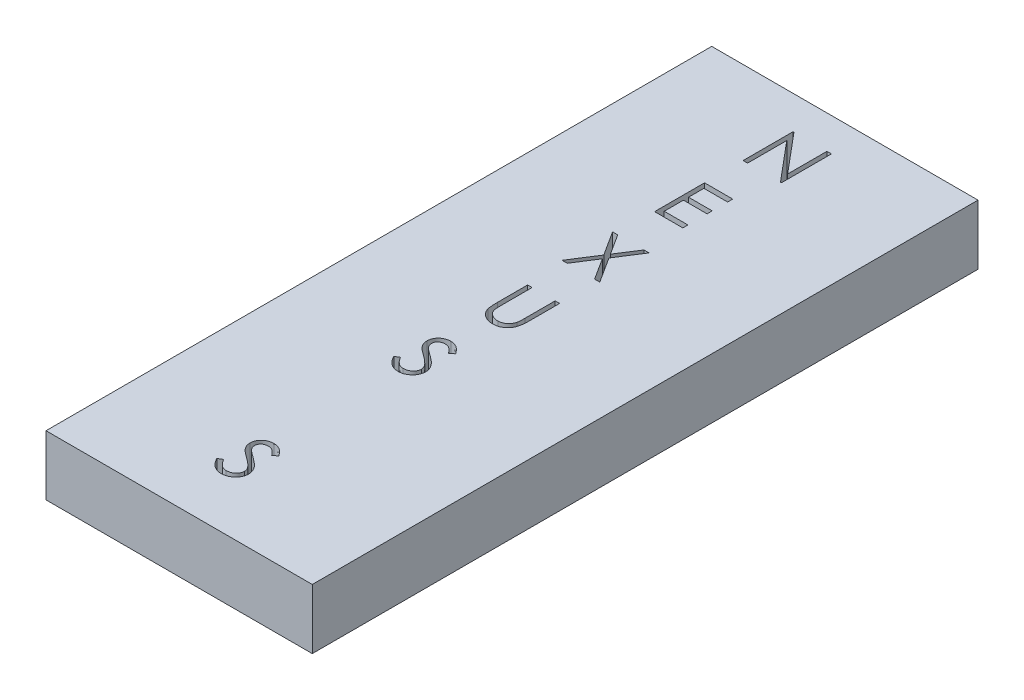
from build123d import *

# Parameters (mm, degrees)
SKETCH1_W           = 50.8
SKETCH1_H           = 127
BOSS_EXTRUDE1_DEPTH = 11.43
CUT_EXTRUDE1_DEPTH  = 138.25991731


with BuildPart() as part:
    # Sketch1 → Boss-Extrude1 (new body)
    with BuildSketch(Plane(origin=(0, 0, 0), x_dir=(1, 0, 0), z_dir=(0, 1, 0))):
        with Locations((25.4, 63.5)):
            Rectangle(SKETCH1_W, SKETCH1_H)
    extrude(amount=BOSS_EXTRUDE1_DEPTH)

    # Sketch2 → Cut-Extrude1 (cut, through all)
    with BuildSketch(Plane(origin=(0, 11.43, 0), x_dir=(1, 0, 0), z_dir=(0, 1, 0))):
        Polygon((21.858653846, 111.125), (21.858653846, 120.65), (22.038010817, 120.65), (28.330769231, 113.153260216), (28.330769231, 120.65), (29.185576923, 120.65), (29.185576923, 111.125), (28.990955529, 111.125), (22.713461538, 118.604567308), (22.713461538, 111.125), align=None)
        Polygon((21.858653846, 103.775), (27.231730769, 103.775), (27.231730769, 102.798076923), (22.713461538, 102.798076923), (22.713461538, 99.867307692), (27.231730769, 99.867307692), (27.231730769, 98.890384615), (22.713461538, 98.890384615), (22.713461538, 95.226923077), (27.231730769, 95.226923077), (27.231730769, 94.25), (21.858653846, 94.25), align=None)
        Polygon((21.187019231, 86.9), (22.173482572, 86.9), (24.667307692, 83.00375601), (27.161132812, 86.9), (28.147596154, 86.9), (25.161493389, 82.232902644), (28.269711538, 77.375), (27.283248197, 77.375), (24.667307692, 81.462049279), (22.051367188, 77.375), (21.064903846, 77.375), (24.175030048, 82.232902644), align=None)
        with BuildLine():
            Line((21.858653846, 70.025), (22.713461538, 70.025))
            Line((22.713461538, 70.025), (22.713461538, 64.318013822))
            add(Edge.make_bspline(
                [(22.713461538, 64.318013822), (22.713334328, 64.23723982), (22.713092924, 64.083957231), (22.714705409, 63.865784927), (22.719221261, 63.671822021), (22.72206831, 63.501320853), (22.728401982, 63.355063805), (22.733567381, 63.232258495), (22.740209182, 63.133486416), (22.748191451, 63.075844038), (22.751622596, 63.051066707)],
                knots=[0, 0, 0, 0, 1.528628734, 2.90083645, 4.128790002, 5.200304208, 6.127813768, 6.898992206, 7.526736466, 8, 8, 8, 8], degree=3))
            add(Edge.make_bspline(
                [(22.751622596, 63.051066707), (22.76571268, 62.961676586), (22.793098923, 62.787933159), (22.862893709, 62.540532764), (22.960368479, 62.317562152), (23.075874188, 62.112063567), (23.228090795, 61.929756809), (23.41043613, 61.761812954), (23.631355629, 61.614932542), (23.87699342, 61.480627833), (24.141748245, 61.372682145), (24.412288905, 61.291057346), (24.684548727, 61.241312626), (24.866819577, 61.235552616), (24.957331731, 61.232692308)],
                knots=[0, 0, 0, 0, 1.035780045, 2.013197591, 2.933192213, 3.817615948, 4.702609284, 5.640816605, 6.646850145, 7.73207398, 8.84249596, 9.914020372, 10.964143139, 12, 12, 12, 12], degree=3))
            add(Edge.make_bspline(
                [(24.957331731, 61.232692308), (25.035038696, 61.235614715), (25.190003811, 61.241442649), (25.420254168, 61.277532686), (25.644500178, 61.342576369), (25.863849172, 61.426504568), (26.069455779, 61.537396227), (26.261434718, 61.665496155), (26.432786567, 61.81574861), (26.589154404, 61.982028833), (26.725320908, 62.169643575), (26.843352372, 62.37450765), (26.940033652, 62.599704087), (26.987777102, 62.757967193), (27.012304687, 62.839272837)],
                knots=[0, 0, 0, 0, 0.994687771, 1.983630487, 2.973142513, 3.978332533, 4.983357753, 5.956394766, 6.925816176, 7.893390482, 8.871859704, 9.88551698, 10.913711441, 12, 12, 12, 12], degree=3))
            add(Edge.make_bspline(
                [(27.012304687, 62.839272837), (27.020469314, 62.8728786), (27.038663393, 62.947765783), (27.05566428, 63.074370152), (27.073371324, 63.223747635), (27.085657403, 63.396971497), (27.09763501, 63.593461287), (27.10480073, 63.814240602), (27.108112798, 64.05850776), (27.109099807, 64.228970321), (27.109615385, 64.318013822)],
                knots=[0, 0, 0, 0, 0.558680831, 1.244966039, 2.062412453, 2.990489873, 4.051219941, 5.244515665, 6.560634259, 8, 8, 8, 8], degree=3))
            Line((27.109615385, 64.318013822), (27.109615385, 70.025))
            Line((27.109615385, 70.025), (27.964423077, 70.025))
            Line((27.964423077, 70.025), (27.964423077, 64.272220553))
            add(Edge.make_bspline(
                [(27.964423077, 64.272220553), (27.963731506, 64.168538536), (27.962381865, 63.966196776), (27.950678153, 63.669693435), (27.932017318, 63.388425678), (27.905651878, 63.122355698), (27.870716891, 62.872435594), (27.831867898, 62.63647476), (27.782393597, 62.416166973), (27.724608413, 62.209794465), (27.658549686, 62.013346746), (27.572984846, 61.826905445), (27.4765796, 61.644802686), (27.362239723, 61.469792761), (27.233757317, 61.301100784), (27.088292386, 61.139749802), (26.93065592, 60.983161397), (26.758227404, 60.835352267), (26.573849189, 60.699801511), (26.378069733, 60.580609005), (26.172392952, 60.479851875), (25.957353487, 60.396913823), (25.732859571, 60.334553378), (25.498905542, 60.288084562), (25.25495888, 60.261680452), (25.089047923, 60.257756342), (25.005033053, 60.255769231)],
                knots=[0, 0, 0, 0, 1.316592851, 2.569410997, 3.76748051, 4.895814652, 5.963796859, 6.97159953, 7.931736103, 8.829262218, 9.692595152, 10.560224239, 11.431080259, 12.30701507, 13.211635791, 14.121146779, 15.063487852, 16.031507147, 17.00238618, 17.966455255, 18.938106653, 19.907068911, 20.888905087, 21.893141452, 22.933117798, 24, 24, 24, 24], degree=3))
            add(Edge.make_bspline(
                [(25.005033053, 60.255769231), (24.913404995, 60.257904913), (24.733631073, 60.262095115), (24.468732476, 60.286105599), (24.214784556, 60.331331372), (23.969105205, 60.388916648), (23.735039224, 60.468338104), (23.509450636, 60.561133715), (23.296203082, 60.675099688), (23.091837053, 60.801900279), (22.901813967, 60.944570187), (22.727377463, 61.100073089), (22.568239558, 61.265917973), (22.427082606, 61.443900397), (22.301567913, 61.632636114), (22.193444975, 61.832659046), (22.100608218, 62.043891749), (22.052693203, 62.19072153), (22.028470553, 62.264948918)],
                knots=[0, 0, 0, 0, 1.13879206, 2.234305948, 3.301075583, 4.341971843, 5.366689343, 6.369221514, 7.369726634, 8.367512178, 9.355451585, 10.318319045, 11.268648973, 12.207971039, 13.137398894, 14.081662264, 15.030215811, 16, 16, 16, 16], degree=3))
            add(Edge.make_bspline(
                [(22.028470553, 62.264948918), (22.014381287, 62.315656139), (21.983821355, 62.425641229), (21.951095366, 62.60766803), (21.923584222, 62.817258628), (21.897715525, 63.054427367), (21.882451146, 63.319358076), (21.869068688, 63.611935911), (21.858559568, 63.93251465), (21.858621542, 64.155820153), (21.858653846, 64.272220553)],
                knots=[0, 0, 0, 0, 0.625038921, 1.35572334, 2.194682327, 3.136881307, 4.189498639, 5.346923369, 6.617055217, 8, 8, 8, 8], degree=3))
            Line((21.858653846, 64.272220553), (21.858653846, 70.025))
        make_face()
        with BuildLine():
            Line((20.881730769, 45.462454928), (21.686929087, 45.945192308))
            add(Edge.make_bspline(
                [(21.686929087, 45.945192308), (21.761818004, 45.819831374), (21.905302279, 45.579644664), (22.14465562, 45.255092425), (22.392667329, 44.979242556), (22.651174015, 44.753699788), (22.918597774, 44.576129604), (23.196684377, 44.45039353), (23.484496705, 44.371972911), (23.680368319, 44.362447676), (23.778155048, 44.357692308)],
                knots=[0, 0, 0, 0, 1.272034388, 2.437168799, 3.508375237, 4.49857839, 5.41946034, 6.295179144, 7.148887113, 8, 8, 8, 8], degree=3))
            add(Edge.make_bspline(
                [(23.778155048, 44.357692308), (23.861667147, 44.360018238), (24.027230079, 44.3646294), (24.270967326, 44.40893644), (24.507682088, 44.477005162), (24.732495595, 44.574489269), (24.942305803, 44.692431862), (25.126292596, 44.834888245), (25.285349518, 44.994380848), (25.415458608, 45.172315072), (25.515280704, 45.363678169), (25.592003405, 45.560099865), (25.634580355, 45.764665755), (25.640994091, 45.902398514), (25.644230769, 45.971905048)],
                knots=[0, 0, 0, 0, 1.095163259, 2.171163733, 3.241058638, 4.321873601, 5.38011039, 6.391990106, 7.366004449, 8.327778327, 9.272591725, 10.192022065, 11.087607919, 12, 12, 12, 12], degree=3))
            add(Edge.make_bspline(
                [(25.644230769, 45.971905048), (25.640218538, 46.051209789), (25.632062258, 46.212424739), (25.563124444, 46.450276652), (25.454677566, 46.685660003), (25.354630657, 46.831259876), (25.302689303, 46.906850962)],
                knots=[0, 0, 0, 0, 0.938893495, 1.908633276, 2.914225137, 4, 4, 4, 4], degree=3))
            add(Edge.make_bspline(
                [(25.302689303, 46.906850962), (25.260042846, 46.96140696), (25.170511943, 47.075940455), (25.016594713, 47.246424988), (24.835984073, 47.4222794), (24.634860827, 47.610218691), (24.405898635, 47.801501909), (24.156268757, 48.00525058), (23.879597826, 48.2137163), (23.685561339, 48.353523068), (23.585441707, 48.425661058)],
                knots=[0, 0, 0, 0, 0.722233717, 1.516239348, 2.393582979, 3.351407094, 4.387010283, 5.505090956, 6.712668013, 8, 8, 8, 8], degree=3))
            add(Edge.make_bspline(
                [(23.585441707, 48.425661058), (23.485227831, 48.497040285), (23.293626533, 48.633511933), (23.025678534, 48.836052306), (22.786071817, 49.021228837), (22.57587135, 49.190784756), (22.39516959, 49.344743059), (22.242542593, 49.481625307), (22.121878377, 49.605133426), (22.054779975, 49.685255935), (22.024654447, 49.721228966)],
                knots=[0, 0, 0, 0, 1.452282411, 2.77665338, 3.964542531, 5.026858415, 5.96415736, 6.766646006, 7.446254459, 8, 8, 8, 8], degree=3))
            add(Edge.make_bspline(
                [(22.024654447, 49.721228966), (21.98254702, 49.777293217), (21.899737115, 49.887551089), (21.7904282, 50.059885166), (21.697520907, 50.236297053), (21.624689132, 50.417260799), (21.563358422, 50.600235855), (21.522107196, 50.787609602), (21.496277037, 50.978541271), (21.493631845, 51.107029441), (21.492307692, 51.171349159)],
                knots=[0, 0, 0, 0, 1.068054152, 2.10047183, 3.106115577, 4.101338837, 5.06977816, 6.043150881, 7.020423561, 8, 8, 8, 8], degree=3))
            add(Edge.make_bspline(
                [(21.492307692, 51.171349159), (21.495859725, 51.272123045), (21.502887869, 51.471516847), (21.562325277, 51.762793607), (21.656140795, 52.040886643), (21.787571882, 52.303042765), (21.957000821, 52.542435899), (22.153068794, 52.761819745), (22.386598625, 52.946247101), (22.642828264, 53.107388489), (22.923288819, 53.233515614), (23.217178349, 53.328659424), (23.524963952, 53.382568904), (23.733433912, 53.390305286), (23.83921274, 53.394230769)],
                knots=[0, 0, 0, 0, 1.005424448, 1.989358655, 2.955360095, 3.929531133, 4.905563448, 5.876582895, 6.856512386, 7.866279853, 8.892233794, 9.918561126, 10.94386622, 12, 12, 12, 12], degree=3))
            add(Edge.make_bspline(
                [(23.83921274, 53.394230769), (23.951455613, 53.390359397), (24.174670863, 53.382660472), (24.503009086, 53.315720048), (24.819132178, 53.204956077), (25.073431349, 53.079256943), (25.272456936, 52.95371359), (25.424238444, 52.83935964), (25.578046649, 52.707710237), (25.735122213, 52.558414718), (25.892803579, 52.390103202), (26.053431688, 52.203928399), (26.217382162, 52.001028057), (26.322853467, 51.85618138), (26.376923077, 51.781926082)],
                knots=[0, 0, 0, 0, 1.286793592, 2.559021753, 3.825965368, 5.121522368, 5.803751409, 6.523245864, 7.299691795, 8.125521123, 9.008227632, 9.944561021, 10.946284179, 12, 12, 12, 12], degree=3))
            Line((26.376923077, 51.781926082), (25.604161659, 51.196153846))
            add(Edge.make_bspline(
                [(25.604161659, 51.196153846), (25.557500228, 51.256266639), (25.467641223, 51.372029824), (25.331217405, 51.534148905), (25.202633585, 51.682239467), (25.075949997, 51.810868137), (24.957857328, 51.927078942), (24.843238806, 52.026573709), (24.733743893, 52.110327294), (24.595721443, 52.199708696), (24.422318224, 52.288308895), (24.204646022, 52.363281743), (23.977171945, 52.408335162), (23.822242019, 52.414292063), (23.743810096, 52.417307692)],
                knots=[0, 0, 0, 0, 1.181633172, 2.275549214, 3.290209073, 4.226197932, 5.078386478, 5.862611352, 6.581680152, 7.217281963, 8.414376989, 9.595101626, 10.782541182, 12, 12, 12, 12], degree=3))
            add(Edge.make_bspline(
                [(23.743810096, 52.417307692), (23.645412703, 52.414010137), (23.4556626, 52.407651114), (23.186267743, 52.338200296), (22.94380499, 52.228848234), (22.735472652, 52.075591043), (22.562017022, 51.894014628), (22.436544309, 51.685066458), (22.361024218, 51.454337205), (22.3518087, 51.293387412), (22.347115385, 51.211418269)],
                knots=[0, 0, 0, 0, 1.14458467, 2.207223713, 3.21896685, 4.227309161, 5.202851033, 6.127160689, 7.046193047, 8, 8, 8, 8], degree=3))
            add(Edge.make_bspline(
                [(22.347115385, 51.211418269), (22.348185251, 51.16038746), (22.350326732, 51.058242395), (22.38019386, 50.907335311), (22.418564177, 50.756809452), (22.479368053, 50.607341566), (22.563311344, 50.456317632), (22.673543287, 50.301137046), (22.812372372, 50.140432039), (22.91871767, 50.035909114), (22.974864784, 49.980724159)],
                knots=[0, 0, 0, 0, 0.858281714, 1.717966888, 2.583508476, 3.4729293, 4.427298488, 5.488583878, 6.674047936, 8, 8, 8, 8], degree=3))
            add(Edge.make_bspline(
                [(22.974864784, 49.980724159), (22.995714661, 49.962117681), (23.045249198, 49.91791295), (23.135807253, 49.845543958), (23.25539444, 49.756273556), (23.400888002, 49.645818073), (23.574970608, 49.517689237), (23.7776614, 49.373525335), (24.006701, 49.208646336), (24.169229928, 49.093373315), (24.255168269, 49.032421875)],
                knots=[0, 0, 0, 0, 0.420754252, 0.999615792, 1.744751191, 2.668019286, 3.750313428, 4.999500688, 6.413464383, 8, 8, 8, 8], degree=3))
            add(Edge.make_bspline(
                [(24.255168269, 49.032421875), (24.358544219, 48.957197889), (24.558717418, 48.811537067), (24.843535546, 48.592691538), (25.101782267, 48.378657253), (25.334364271, 48.170801051), (25.543579286, 47.970699598), (25.727106226, 47.775945514), (25.886815113, 47.587934063), (26.058752843, 47.346890125), (26.234442338, 47.050850174), (26.38532244, 46.688142968), (26.480459086, 46.324025838), (26.492900139, 46.079296376), (26.499038462, 45.958548678)],
                knots=[0, 0, 0, 0, 1.163667725, 2.253281268, 3.268753668, 4.215851969, 5.092017293, 5.902905408, 6.650798638, 7.335211899, 8.59617414, 9.77448103, 10.901945474, 12, 12, 12, 12], degree=3))
            add(Edge.make_bspline(
                [(26.499038462, 45.958548678), (26.497250107, 45.873154699), (26.493708127, 45.704025033), (26.452993069, 45.45568086), (26.393340266, 45.214478279), (26.303431793, 44.983398751), (26.193695198, 44.75821479), (26.054449909, 44.54483329), (25.893048282, 44.338531591), (25.70789925, 44.144810803), (25.505300044, 43.966975799), (25.29116799, 43.80878171), (25.065152604, 43.67687863), (24.828479985, 43.569243838), (24.581095769, 43.48506048), (24.323083157, 43.424065457), (24.054016844, 43.386630273), (23.871135534, 43.382744722), (23.778155048, 43.380769231)],
                knots=[0, 0, 0, 0, 0.983748083, 1.948392443, 2.894712957, 3.844097841, 4.80183111, 5.778335162, 6.776009319, 7.81870978, 8.863265674, 9.881300176, 10.883814829, 11.87499822, 12.874611388, 13.892143829, 14.928324115, 16, 16, 16, 16], degree=3))
            add(Edge.make_bspline(
                [(23.778155048, 43.380769231), (23.70621315, 43.382160375), (23.563235389, 43.384925143), (23.351754585, 43.409367057), (23.144546131, 43.443948531), (22.944210121, 43.498850822), (22.748165451, 43.565463166), (22.557264763, 43.647482486), (22.371415537, 43.74577287), (22.189576258, 43.85815433), (22.012209397, 43.988940049), (21.84097856, 44.141267921), (21.670265562, 44.31093676), (21.505109148, 44.502554079), (21.342168662, 44.713024147), (21.184656705, 44.944316139), (21.029312887, 45.195170223), (20.93184365, 45.371695921), (20.881730769, 45.462454928)],
                knots=[0, 0, 0, 0, 0.915332311, 1.819136955, 2.706846663, 3.586547465, 4.459518054, 5.340707479, 6.227863349, 7.133153174, 8.059268498, 9.028702269, 10.047606654, 11.120612155, 12.245963614, 13.433783089, 14.680604001, 16, 16, 16, 16], degree=3))
        make_face()
        with BuildLine():
            Line((20.881730769, 11.712454928), (21.686929087, 12.195192308))
            add(Edge.make_bspline(
                [(21.686929087, 12.195192308), (21.761818004, 12.069831374), (21.905302279, 11.829644664), (22.14465562, 11.505092425), (22.392667329, 11.229242556), (22.651174015, 11.003699788), (22.918597774, 10.826129604), (23.196684377, 10.70039353), (23.484496705, 10.621972911), (23.680368319, 10.612447676), (23.778155048, 10.607692308)],
                knots=[0, 0, 0, 0, 1.272034388, 2.437168799, 3.508375237, 4.49857839, 5.41946034, 6.295179144, 7.148887113, 8, 8, 8, 8], degree=3))
            add(Edge.make_bspline(
                [(23.778155048, 10.607692308), (23.861667147, 10.610018238), (24.027230079, 10.6146294), (24.270967326, 10.65893644), (24.507682088, 10.727005162), (24.732495595, 10.824489269), (24.942305803, 10.942431862), (25.126292596, 11.084888245), (25.285349518, 11.244380848), (25.415458608, 11.422315072), (25.515280704, 11.613678169), (25.592003405, 11.810099865), (25.634580355, 12.014665755), (25.640994091, 12.152398514), (25.644230769, 12.221905048)],
                knots=[0, 0, 0, 0, 1.095163259, 2.171163733, 3.241058638, 4.321873601, 5.38011039, 6.391990106, 7.366004449, 8.327778327, 9.272591725, 10.192022065, 11.087607919, 12, 12, 12, 12], degree=3))
            add(Edge.make_bspline(
                [(25.644230769, 12.221905048), (25.640218538, 12.301209789), (25.632062258, 12.462424739), (25.563124444, 12.700276652), (25.454677566, 12.935660003), (25.354630657, 13.081259876), (25.302689303, 13.156850962)],
                knots=[0, 0, 0, 0, 0.938893495, 1.908633276, 2.914225137, 4, 4, 4, 4], degree=3))
            add(Edge.make_bspline(
                [(25.302689303, 13.156850962), (25.260042846, 13.21140696), (25.170511943, 13.325940455), (25.016594713, 13.496424988), (24.835984073, 13.6722794), (24.634860827, 13.860218691), (24.405898635, 14.051501909), (24.156268757, 14.25525058), (23.879597826, 14.4637163), (23.685561339, 14.603523068), (23.585441707, 14.675661058)],
                knots=[0, 0, 0, 0, 0.722233717, 1.516239348, 2.393582979, 3.351407094, 4.387010283, 5.505090956, 6.712668013, 8, 8, 8, 8], degree=3))
            add(Edge.make_bspline(
                [(23.585441707, 14.675661058), (23.485227831, 14.747040285), (23.293626533, 14.883511933), (23.025678534, 15.086052306), (22.786071817, 15.271228837), (22.57587135, 15.440784756), (22.39516959, 15.594743059), (22.242542593, 15.731625307), (22.121878377, 15.855133426), (22.054779975, 15.935255935), (22.024654447, 15.971228966)],
                knots=[0, 0, 0, 0, 1.452282411, 2.77665338, 3.964542531, 5.026858415, 5.96415736, 6.766646006, 7.446254459, 8, 8, 8, 8], degree=3))
            add(Edge.make_bspline(
                [(22.024654447, 15.971228966), (21.98254702, 16.027293217), (21.899737115, 16.137551089), (21.7904282, 16.309885166), (21.697520907, 16.486297053), (21.624689132, 16.667260799), (21.563358422, 16.850235855), (21.522107196, 17.037609602), (21.496277037, 17.228541271), (21.493631845, 17.357029441), (21.492307692, 17.421349159)],
                knots=[0, 0, 0, 0, 1.068054152, 2.10047183, 3.106115577, 4.101338837, 5.06977816, 6.043150881, 7.020423561, 8, 8, 8, 8], degree=3))
            add(Edge.make_bspline(
                [(21.492307692, 17.421349159), (21.495859725, 17.522123045), (21.502887869, 17.721516847), (21.562325277, 18.012793607), (21.656140795, 18.290886643), (21.787571882, 18.553042765), (21.957000821, 18.792435899), (22.153068794, 19.011819745), (22.386598625, 19.196247101), (22.642828264, 19.357388489), (22.923288819, 19.483515614), (23.217178349, 19.578659424), (23.524963952, 19.632568904), (23.733433912, 19.640305286), (23.83921274, 19.644230769)],
                knots=[0, 0, 0, 0, 1.005424448, 1.989358655, 2.955360095, 3.929531133, 4.905563448, 5.876582895, 6.856512386, 7.866279853, 8.892233794, 9.918561126, 10.94386622, 12, 12, 12, 12], degree=3))
            add(Edge.make_bspline(
                [(23.83921274, 19.644230769), (23.951455613, 19.640359397), (24.174670863, 19.632660472), (24.503009086, 19.565720048), (24.819132178, 19.454956077), (25.073431349, 19.329256943), (25.272456936, 19.20371359), (25.424238444, 19.08935964), (25.578046649, 18.957710237), (25.735122213, 18.808414718), (25.892803579, 18.640103202), (26.053431688, 18.453928399), (26.217382162, 18.251028057), (26.322853467, 18.10618138), (26.376923077, 18.031926082)],
                knots=[0, 0, 0, 0, 1.286793592, 2.559021753, 3.825965368, 5.121522368, 5.803751409, 6.523245864, 7.299691795, 8.125521123, 9.008227632, 9.944561021, 10.946284179, 12, 12, 12, 12], degree=3))
            Line((26.376923077, 18.031926082), (25.604161659, 17.446153846))
            add(Edge.make_bspline(
                [(25.604161659, 17.446153846), (25.557500228, 17.506266639), (25.467641223, 17.622029824), (25.331217405, 17.784148905), (25.202633585, 17.932239467), (25.075949997, 18.060868137), (24.957857328, 18.177078942), (24.843238806, 18.276573709), (24.733743893, 18.360327294), (24.595721443, 18.449708696), (24.422318224, 18.538308895), (24.204646022, 18.613281743), (23.977171945, 18.658335162), (23.822242019, 18.664292063), (23.743810096, 18.667307692)],
                knots=[0, 0, 0, 0, 1.181633172, 2.275549214, 3.290209073, 4.226197932, 5.078386478, 5.862611352, 6.581680152, 7.217281963, 8.414376989, 9.595101626, 10.782541182, 12, 12, 12, 12], degree=3))
            add(Edge.make_bspline(
                [(23.743810096, 18.667307692), (23.645412703, 18.664010137), (23.4556626, 18.657651114), (23.186267743, 18.588200296), (22.94380499, 18.478848234), (22.735472652, 18.325591043), (22.562017022, 18.144014628), (22.436544309, 17.935066458), (22.361024218, 17.704337205), (22.3518087, 17.543387412), (22.347115385, 17.461418269)],
                knots=[0, 0, 0, 0, 1.14458467, 2.207223713, 3.21896685, 4.227309161, 5.202851033, 6.127160689, 7.046193047, 8, 8, 8, 8], degree=3))
            add(Edge.make_bspline(
                [(22.347115385, 17.461418269), (22.348185251, 17.41038746), (22.350326732, 17.308242395), (22.38019386, 17.157335311), (22.418564177, 17.006809452), (22.479368053, 16.857341566), (22.563311344, 16.706317632), (22.673543287, 16.551137046), (22.812372372, 16.390432039), (22.91871767, 16.285909114), (22.974864784, 16.230724159)],
                knots=[0, 0, 0, 0, 0.858281714, 1.717966888, 2.583508476, 3.4729293, 4.427298488, 5.488583878, 6.674047936, 8, 8, 8, 8], degree=3))
            add(Edge.make_bspline(
                [(22.974864784, 16.230724159), (22.995714661, 16.212117681), (23.045249198, 16.16791295), (23.135807253, 16.095543958), (23.25539444, 16.006273556), (23.400888002, 15.895818073), (23.574970608, 15.767689237), (23.7776614, 15.623525335), (24.006701, 15.458646336), (24.169229928, 15.343373315), (24.255168269, 15.282421875)],
                knots=[0, 0, 0, 0, 0.420754252, 0.999615792, 1.744751191, 2.668019286, 3.750313428, 4.999500688, 6.413464383, 8, 8, 8, 8], degree=3))
            add(Edge.make_bspline(
                [(24.255168269, 15.282421875), (24.358544219, 15.207197889), (24.558717418, 15.061537067), (24.843535546, 14.842691538), (25.101782267, 14.628657253), (25.334364271, 14.420801051), (25.543579286, 14.220699598), (25.727106226, 14.025945514), (25.886815113, 13.837934063), (26.058752843, 13.596890125), (26.234442338, 13.300850174), (26.38532244, 12.938142968), (26.480459086, 12.574025838), (26.492900139, 12.329296376), (26.499038462, 12.208548678)],
                knots=[0, 0, 0, 0, 1.163667725, 2.253281268, 3.268753668, 4.215851969, 5.092017293, 5.902905408, 6.650798638, 7.335211899, 8.59617414, 9.77448103, 10.901945474, 12, 12, 12, 12], degree=3))
            add(Edge.make_bspline(
                [(26.499038462, 12.208548678), (26.497250107, 12.123154699), (26.493708127, 11.954025033), (26.452993069, 11.70568086), (26.393340266, 11.464478279), (26.303431793, 11.233398751), (26.193695198, 11.00821479), (26.054449909, 10.79483329), (25.893048282, 10.588531591), (25.70789925, 10.394810803), (25.505300044, 10.216975799), (25.29116799, 10.05878171), (25.065152604, 9.92687863), (24.828479985, 9.819243838), (24.581095769, 9.73506048), (24.323083157, 9.674065457), (24.054016844, 9.636630273), (23.871135534, 9.632744722), (23.778155048, 9.630769231)],
                knots=[0, 0, 0, 0, 0.983748083, 1.948392443, 2.894712957, 3.844097841, 4.80183111, 5.778335162, 6.776009319, 7.81870978, 8.863265674, 9.881300176, 10.883814829, 11.87499822, 12.874611388, 13.892143829, 14.928324115, 16, 16, 16, 16], degree=3))
            add(Edge.make_bspline(
                [(23.778155048, 9.630769231), (23.70621315, 9.632160375), (23.563235389, 9.634925143), (23.351754585, 9.659367057), (23.144546131, 9.693948531), (22.944210121, 9.748850822), (22.748165451, 9.815463166), (22.557264763, 9.897482486), (22.371415537, 9.99577287), (22.189576258, 10.10815433), (22.012209397, 10.238940049), (21.84097856, 10.391267921), (21.670265562, 10.56093676), (21.505109148, 10.752554079), (21.342168662, 10.963024147), (21.184656705, 11.194316139), (21.029312887, 11.445170223), (20.93184365, 11.621695921), (20.881730769, 11.712454928)],
                knots=[0, 0, 0, 0, 0.915332311, 1.819136955, 2.706846663, 3.586547465, 4.459518054, 5.340707479, 6.227863349, 7.133153174, 8.059268498, 9.028702269, 10.047606654, 11.120612155, 12.245963614, 13.433783089, 14.680604001, 16, 16, 16, 16], degree=3))
        make_face()
    extrude(amount=-CUT_EXTRUDE1_DEPTH, mode=Mode.SUBTRACT)


solid = part.part
